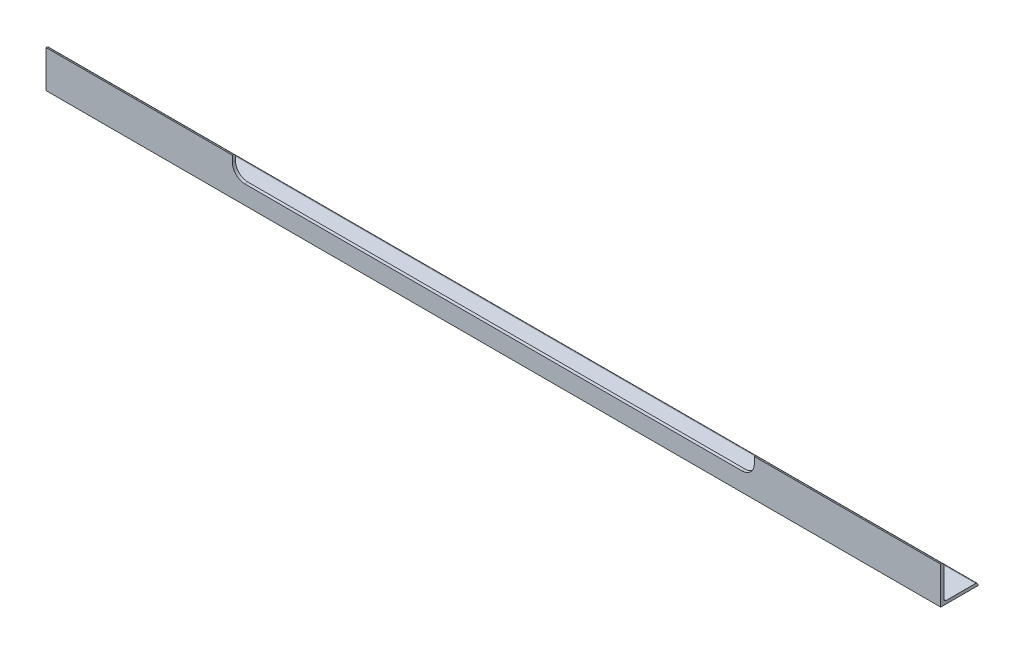
from build123d import *

# Parameters (mm, degrees)
BOSS_EXTRUDE1_DEPTH      = 914.4
BOSS_EXTRUDE1_DEPTH_BACK = 914.4
SKETCH2_W                = 1066.8
SKETCH2_H                = 38.1
CUT_EXTRUDE1_DEPTH       = 921.728103188
FILLET1_R                = 25.4


with BuildPart() as part:
    # Sketch1 → Boss-Extrude1 (new, two sides: drawn at the far end of the back side and taken through both)
    with BuildSketch(Plane(origin=(0, 0, 0), x_dir=(0, 0, -1), z_dir=(1, 0, 0)).offset(-BOSS_EXTRUDE1_DEPTH_BACK)):
        with BuildLine():
            Line((0, 76.2), (0, 0))
            Line((0, 0), (76.2, 0))
            Line((76.2, 0), (76.2, 1.27))
            ThreePointArc((76.2, 1.27), (74.712102448, 4.862102448), (71.12, 6.35))
            Line((71.12, 6.35), (11.43, 6.35))
            ThreePointArc((11.43, 6.35), (7.837897552, 7.837897552), (6.35, 11.43))
            Line((6.35, 11.43), (6.35, 71.12))
            ThreePointArc((6.35, 71.12), (4.862102448, 74.712102448), (1.27, 76.2))
            Line((1.27, 76.2), (0, 76.2))
        make_face()
    extrude(amount=BOSS_EXTRUDE1_DEPTH + BOSS_EXTRUDE1_DEPTH_BACK)

    # Sketch2 → Cut-Extrude1 (cut, through all)
    with BuildSketch(Plane.XY):
        with Locations((0, 57.15)):
            Rectangle(SKETCH2_W, SKETCH2_H)
    extrude(amount=-CUT_EXTRUDE1_DEPTH, mode=Mode.SUBTRACT)

    # Fillet1
    fillet1_edges = [part.edges().sort_by_distance(p)[0] for p in [
        (533.4, 38.1, -3.175),
        (-533.4, 38.1, -3.175),
    ]]
    fillet(fillet1_edges, radius=FILLET1_R)


solid = part.part
